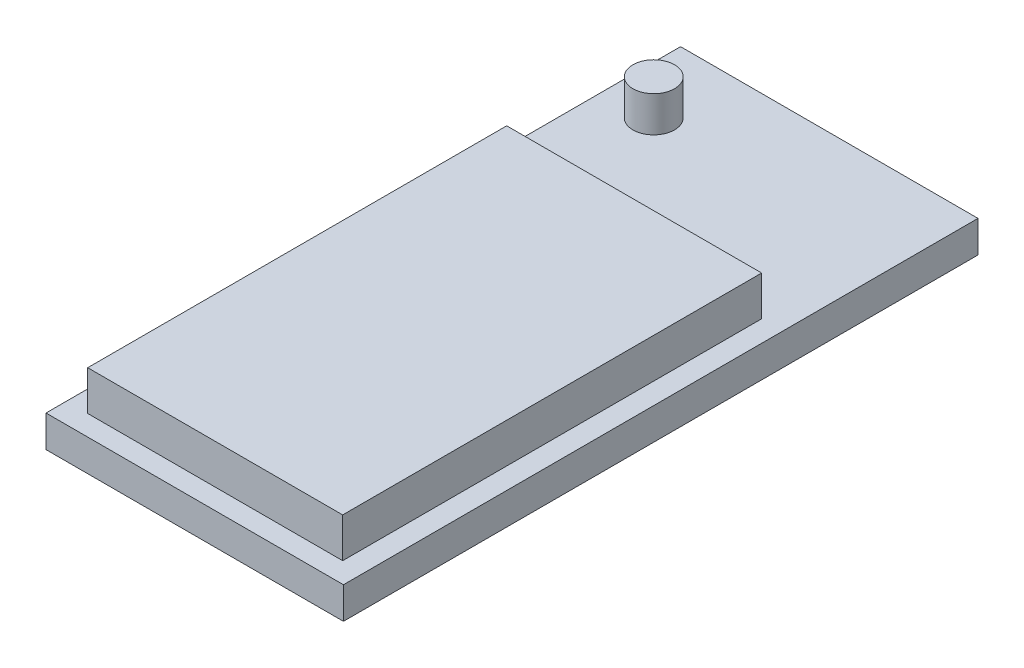
from build123d import *

# Parameters (mm, degrees)
SKETCH_1_W      = 15
SKETCH_1_H      = 32
EXTRUDE_1_DEPTH = 1.6
SKETCH_2_W      = 12.857079129
SKETCH_2_H      = 21.128766401
EXTRUDE_2_DEPTH = 2
SKETCH_3_R      = 1.048746982
EXTRUDE_3_DEPTH = 1.8


with BuildPart() as part:
    # 草图1 → 凸台-拉伸1 (new body)
    with BuildSketch(Plane(origin=(0, 0, 0), x_dir=(1, 0, 0), z_dir=(0, 1, 0))):
        Rectangle(SKETCH_1_W, SKETCH_1_H)
    extrude(amount=EXTRUDE_1_DEPTH)

    # 草图2 → 凸台-拉伸2 (add)
    with BuildSketch(Plane(origin=(0, 1.6, 0), x_dir=(1, 0, 0), z_dir=(0, 1, 0))):
        with Locations((0.002075323, -4.405572569)):
            Rectangle(SKETCH_2_W, SKETCH_2_H)
    extrude(amount=EXTRUDE_2_DEPTH)

    # 草图3 → 凸台-拉伸3 (add)
    with BuildSketch(Plane(origin=(0, 1.6, 0), x_dir=(1, 0, 0), z_dir=(0, 1, 0))):
        with Locations(Location((-5.062783927, 12.209984483, 0), (0, 0, 270))):
            Circle(SKETCH_3_R)
    extrude(amount=EXTRUDE_3_DEPTH)


solid = part.part
